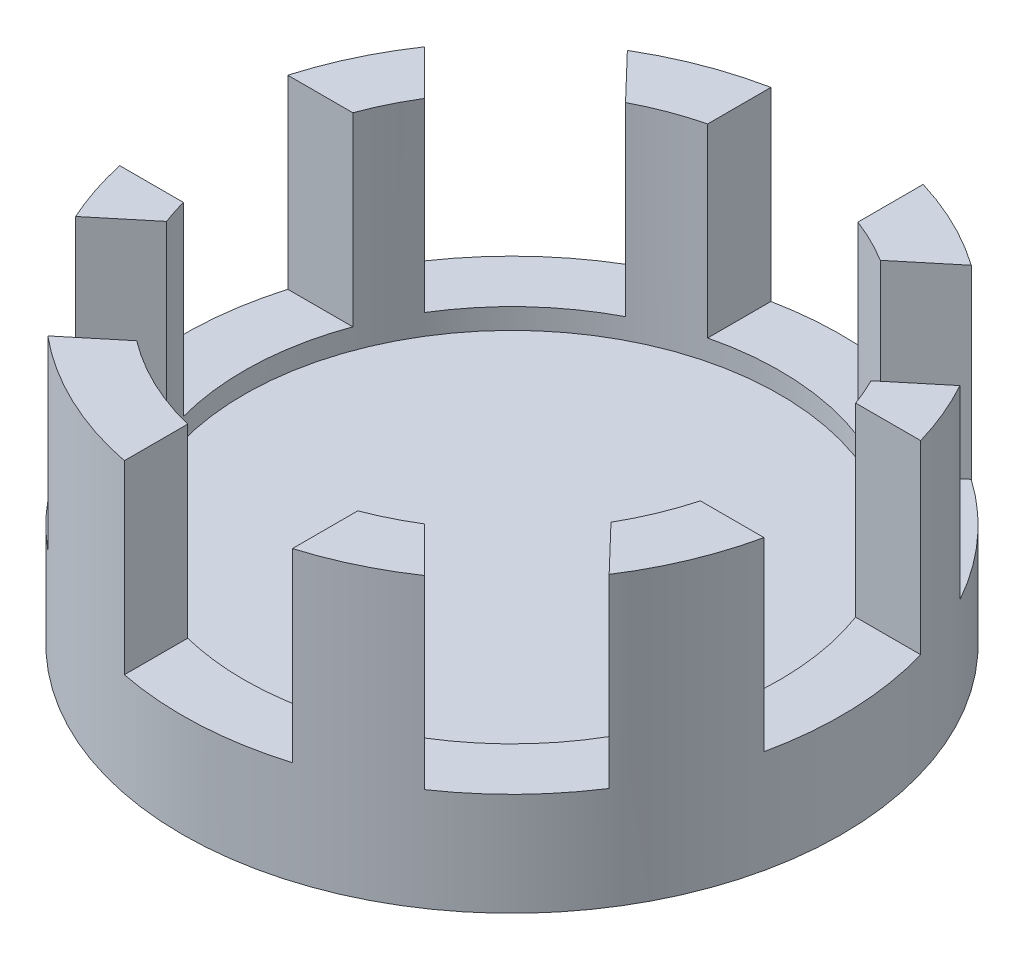
from build123d import *

# Parameters (mm, degrees)
SKETCH_1_R           = 16
EXTRUDE_1_DEPTH      = 20
SKETCH_2_R           = 13
CUT_EXTRUDE_1_DEPTH  = 16
CUT_EXTRUDE_8_DEPTH  = 15
SKETCH_7_W           = 7.773458373
SKETCH_7_H           = 44.148318348
CUT_EXTRUDE_9_DEPTH  = 15
CUT_EXTRUDE_12_DEPTH = 15
CUT_EXTRUDE_14_DEPTH = 6


with BuildPart() as part:
    # 草图1 → 凸台-拉伸1 (new body)
    with BuildSketch(Plane(origin=(0, 0, 0), x_dir=(1, 0, 0), z_dir=(0, 1, 0))):
        with Locations(Location((0, 0, 0), (0, 0, 270))):
            Circle(SKETCH_1_R)
    extrude(amount=EXTRUDE_1_DEPTH)

    # 草图2 → 切除-拉伸1 (cut)
    with BuildSketch(Plane(origin=(0, 20, 0), x_dir=(1, 0, 0), z_dir=(0, 1, 0))):
        with Locations(Location((0, 0, 0), (0, 0, 270))):
            Circle(SKETCH_2_R)
    extrude(amount=-CUT_EXTRUDE_1_DEPTH, mode=Mode.SUBTRACT)

    # Sketch 3D_1 → 切除-拉伸8 (cut)
    with BuildSketch(Plane(origin=(-21.115525012, 20, -4.47842686), x_dir=(0.9837828296095457, 0, 0.17936372031555256), z_dir=(0, -1, 0))):
        Polygon((0, 0), (42.521972379, -7.752624798), (43.935434359, 0), (1.41346198, 7.752624798), align=None)
    extrude(amount=CUT_EXTRUDE_8_DEPTH, mode=Mode.SUBTRACT)

    # 草图7 → 切除-拉伸9 (cut)
    with BuildSketch(Plane(origin=(0, 20, 0), x_dir=(1, 0, 0), z_dir=(0, 1, 0))):
        with Locations((0.764910482, -0.180026065)):
            Rectangle(SKETCH_7_W, SKETCH_7_H)
    extrude(amount=-CUT_EXTRUDE_9_DEPTH, mode=Mode.SUBTRACT)

    # 草图8 → 切除-拉伸12 (cut)
    with BuildSketch(Plane(origin=(0, 20, 0), x_dir=(1, 0, 0), z_dir=(0, 1, 0))):
        Polygon((-0.220684434, -4.025865965), (-5.305815048, 1.059264649), (-20.221668569, -11.283691061), (-18.774175203, -19.378987698), align=None)
        Polygon((-12.618321187, 18.401718398), (-17.471521644, 13.224971244), (-5.305815048, 1.059264649), (-0.097842246, 5.368892492), align=None)
        with BuildLine():
            Line((9.217986526, 13.07779509), (6.801952348, 11.078512728))
            ThreePointArc((6.801952348, 11.078512728), (9.592762697, 8.773762239), (11.63996381, 5.788889574))
            Line((11.63996381, 5.788889574), (14.001568463, 7.743131187))
            ThreePointArc((14.001568463, 7.743131187), (11.912245515, 10.681685578), (9.217986526, 13.07779509))
        make_face()
        Polygon((4.875918089, 0.191602323), (-0.220684434, -4.025865965), (13.346301255, -17.592851655), (19.008368455, -14.519158032), align=None)
    extrude(amount=-CUT_EXTRUDE_12_DEPTH, mode=Mode.SUBTRACT)

    # Sketch 3D_2 → 切除-拉伸14 (cut)
    with BuildSketch(Plane(origin=(17.993102369, 20, -18.234682019), x_dir=(-0.7299619657231169, 0, 0.6834877677015465), z_dir=(0, -1, 0))):
        Polygon((0, 0), (27.649733988, 25.889369376), (51.890815184, 0), (24.241081197, -25.889369376), align=None)
    extrude(amount=CUT_EXTRUDE_14_DEPTH, mode=Mode.SUBTRACT)


solid = part.part
